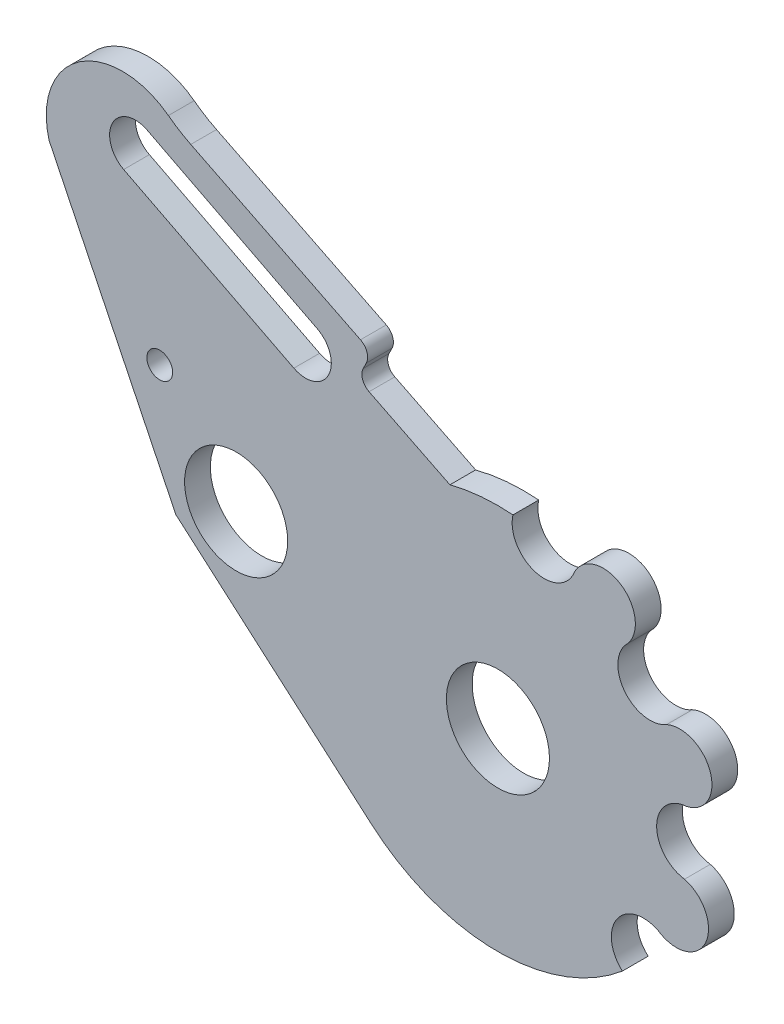
from build123d import *

# Parameters (mm, degrees)
ESQUISSE1_R        = 4
ESQUISSE1_R_2      = 1
BOSS_EXTRU_1_DEPTH = 2
CONG_1_R           = 1
CONG_2_R           = 11


with BuildPart() as part:
    # Esquisse1 → Boss.-Extru.1 (new body)
    with BuildSketch(Plane.XY):
        with BuildLine():
            Line((-3.728432128, 14.529239273), (-10.902133324, 18.092613259))
            Line((-10.902133324, 18.092613259), (-9.77414371, 20.363455577))
            Line((-9.77414371, 20.363455577), (-25.005281494, 27.929179137))
            ThreePointArc((-25.005281494, 27.929179137), (-32.144223962, 28.809157948), (-34.856074883, 22.146971607))
            Line((-34.856074883, 22.146971607), (-25.005281494, 1.884444499))
            Line((-25.005281494, 1.884444499), (-9.850606554, -11.31218593))
            ThreePointArc((-9.850606554, -11.31218593), (-0.12474397, -14.999481289), (9.661100255, -11.47445606))
            ThreePointArc((9.661100255, -11.47445606), (9.328139992, -8.064479271), (12.711512496, -7.524484146))
            ThreePointArc((12.711512496, -7.524484146), (16.183775509, -6.191442889), (14.487891216, -2.881218443))
            ThreePointArc((14.487891216, -2.881218443), (12.323112571, -0.335609675), (14.623234656, 2.088401251))
            ThreePointArc((14.623234656, 2.088401251), (16.496773903, 5.301415429), (13.102212542, 6.821468911))
            ThreePointArc((13.102212542, 6.821468911), (9.820570557, 7.451720018), (10.097110191, 10.781872629))
            ThreePointArc((10.097110191, 10.781872629), (9.547104174, 14.460337363), (5.948313856, 13.521019705))
            ThreePointArc((5.948313856, 13.521019705), (2.883768887, 11.988907316), (1.167882396, 14.954465912))
            ThreePointArc((1.167882396, 14.954465912), (-1.297808983, 14.94375093), (-3.728432128, 14.529239273))
        make_face()
        with Locations((-20.325227829, 4.439090716)):
            Circle(ESQUISSE1_R, mode=Mode.SUBTRACT)
        with Locations((-26.256387143, 11.319323515)):
            Circle(ESQUISSE1_R_2, mode=Mode.SUBTRACT)
        with BuildLine():
            ThreePointArc((-29.058075564, 23.063121212), (-29.928943128, 25.754141406), (-27.237922934, 26.625008971))
            Line((-27.237922934, 26.625008971), (-14.025891569, 19.873557138))
            ThreePointArc((-14.025891569, 19.873557138), (-13.155024005, 17.182536944), (-15.846044199, 16.31166938))
            Line((-15.846044199, 16.31166938), (-29.058075564, 23.063121212))
        make_face(mode=Mode.SUBTRACT)
        Circle(ESQUISSE1_R, mode=Mode.SUBTRACT)
    extrude(amount=BOSS_EXTRU_1_DEPTH)

    # Congé1
    cong_1_edges = [part.edges().sort_by_distance(p)[0] for p in [
        (-9.77414371, 20.363455577, 1),
        (-10.902133324, 18.092613259, 1),
    ]]
    fillet(cong_1_edges, radius=CONG_1_R)

    # Congé2
    cong_2_edges = [part.edges().sort_by_distance(p)[0] for p in [
        (-25.005281494, 27.929179137, 1),
    ]]
    fillet(cong_2_edges, radius=CONG_2_R)


solid = part.part
